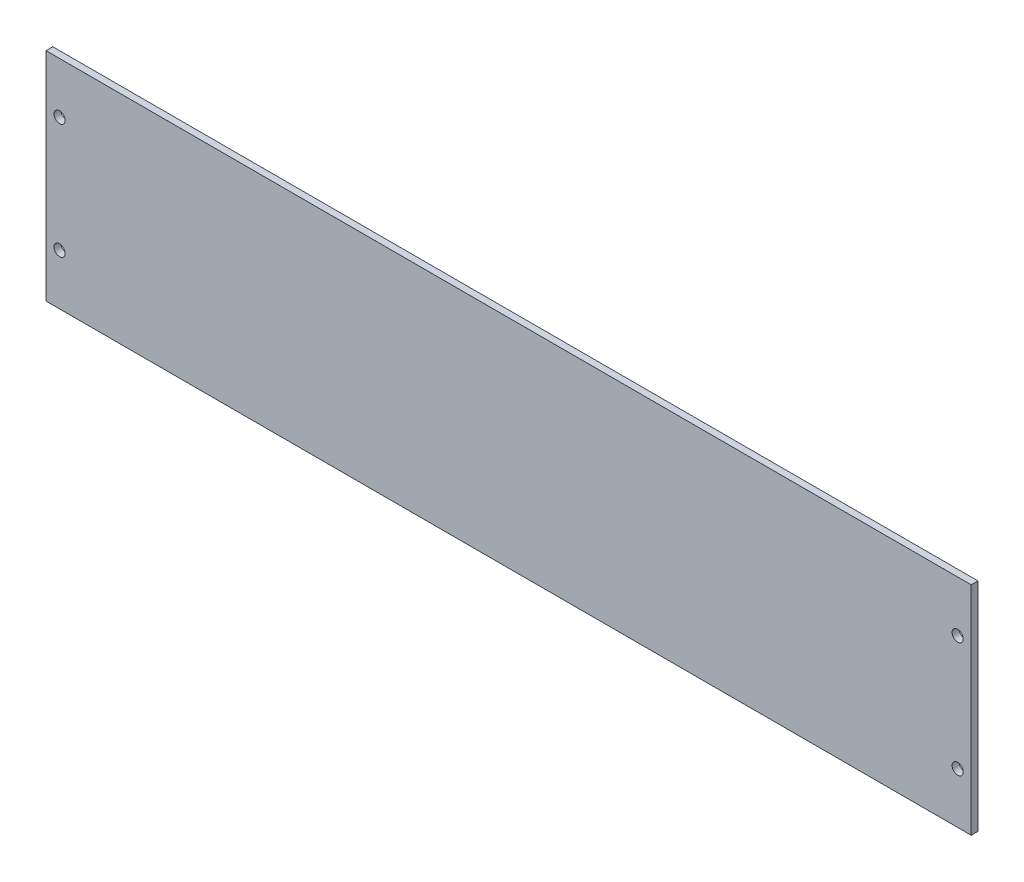
from build123d import *

# Parameters (mm, degrees)
ESQUISSE1_W        = 546
ESQUISSE1_H        = 128
BOSS_EXTRU_1_DEPTH = 4
D_GAGEMENT_M61_D   = 6.6


with BuildPart() as part:
    # Esquisse1 → Boss.-Extru.1 (new body)
    with BuildSketch(Plane.XY):
        Rectangle(ESQUISSE1_W, ESQUISSE1_H)
    extrude(amount=BOSS_EXTRU_1_DEPTH)

    # Dégagement M61 (through all)
    with Locations(Plane(origin=(-265, 34, 0), x_dir=(-1, 0, 0), z_dir=(0, 0, -1))):
        with Locations((0, 0), (0, -68), (-530, -68), (-530, 0)):
            Hole(D_GAGEMENT_M61_D / 2)


solid = part.part
